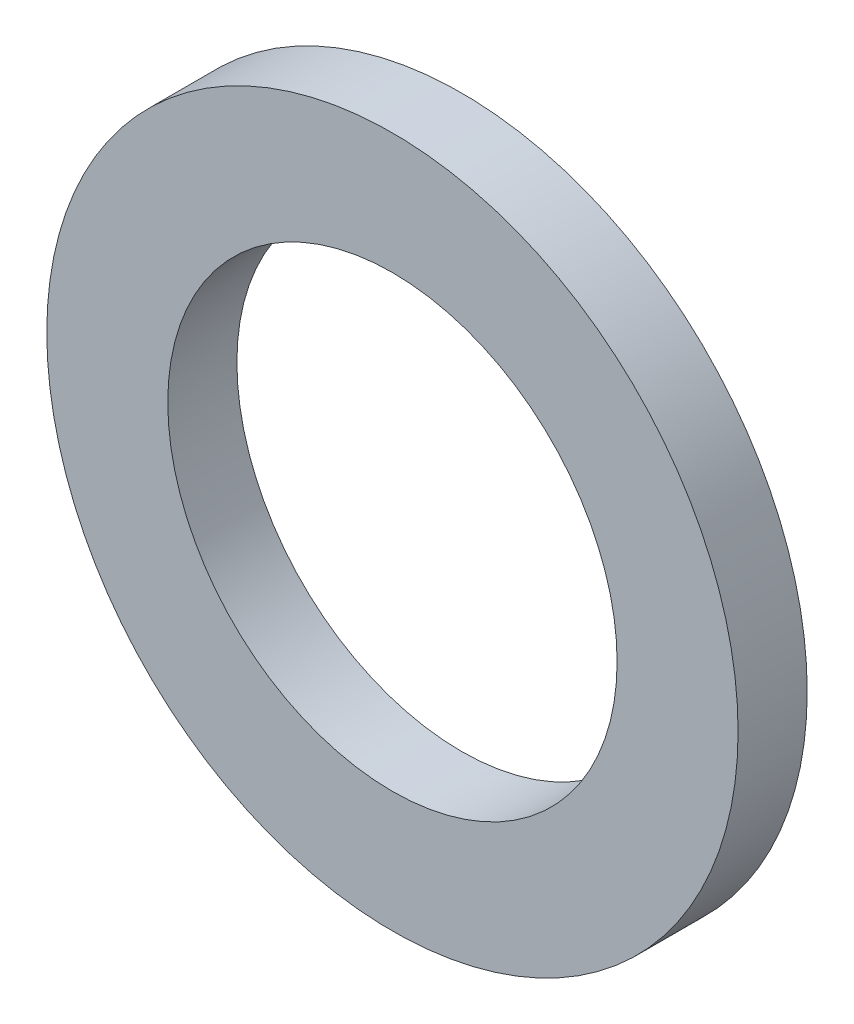
from build123d import *

# Parameters (mm, degrees)
SKETCH_1_R      = 5
SKETCH_1_R_2    = 3.25
EXTRUDE_1_DEPTH = 1


with BuildPart() as part:
    # 草圖1 → 填料-伸長1 (new body)
    with BuildSketch(Plane.XY):
        Circle(SKETCH_1_R)
        Circle(SKETCH_1_R_2, mode=Mode.SUBTRACT)
    extrude(amount=EXTRUDE_1_DEPTH)


solid = part.part
